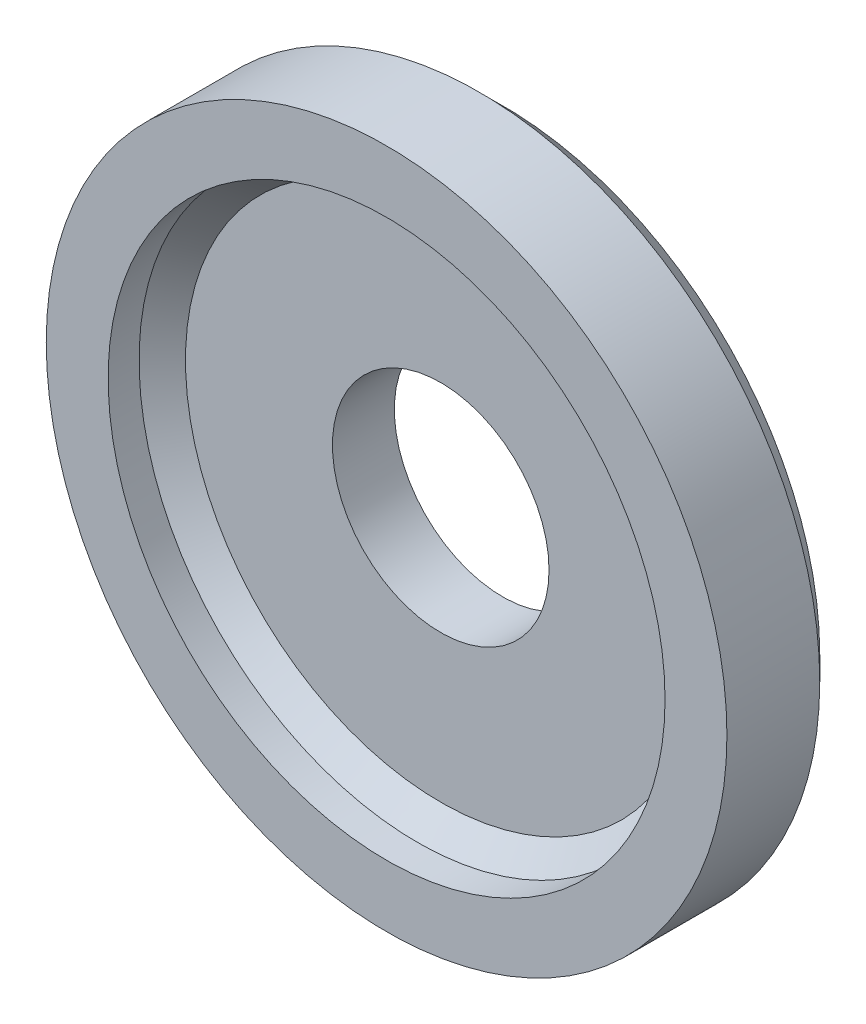
from build123d import *

# Parameters (mm, degrees)
SKETCH1_R           = 11
SKETCH1_R_2         = 3.5
BOSS_EXTRUDE1_DEPTH = 3.75
CHAMFER1_SIZE       = 0.75
SKETCH2_R           = 9
CUT_EXTRUDE1_DEPTH  = 1.75
CHAMFER2_SIZE       = 0.75


with BuildPart() as part:
    # Sketch1 → Boss-Extrude1 (new body)
    with BuildSketch(Plane.XY):
        Circle(SKETCH1_R)
        Circle(SKETCH1_R_2, mode=Mode.SUBTRACT)
    extrude(amount=BOSS_EXTRUDE1_DEPTH)

    # Chamfer1
    chamfer1_edges = [part.edges().sort_by_distance(p)[0] for p in [
        (-11, 0, 0),
    ]]
    chamfer(chamfer1_edges, length=CHAMFER1_SIZE)

    # Sketch2 → Cut-Extrude1 (cut)
    with BuildSketch(Plane.XY.offset(3.75)):
        Circle(SKETCH2_R)
    extrude(amount=-CUT_EXTRUDE1_DEPTH, mode=Mode.SUBTRACT)

    # Chamfer2
    chamfer2_edges = [part.edges().sort_by_distance(p)[0] for p in [
        (-9, 0, 2),
    ]]
    chamfer(chamfer2_edges, length=CHAMFER2_SIZE)


solid = part.part
